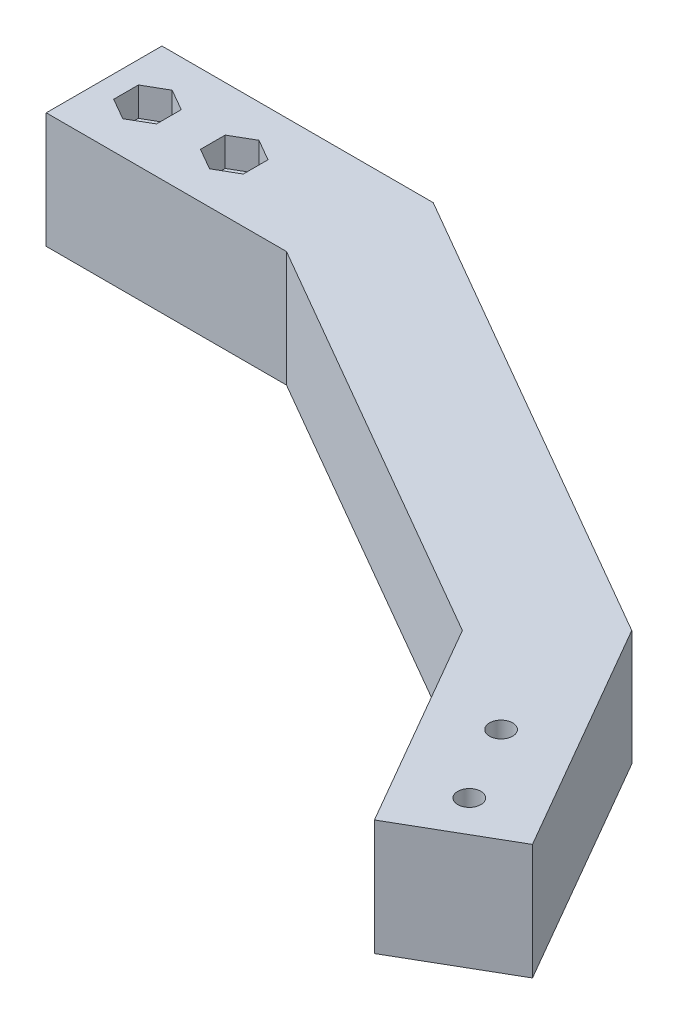
from build123d import *

# Parameters (mm, degrees)
BOSS_EXTRUDE1_DEPTH = 20
SKETCH2_R           = 2
CUT_EXTRUDE1_DEPTH  = 233.365552524
SKETCH2_3_R         = 2
CUT_EXTRUDE2_DEPTH  = 5
CUT_EXTRUDE3_START  = -15
SKETCH2_4_R         = 2
CUT_EXTRUDE3_DEPTH  = 5


with BuildPart() as part:
    # Sketch1 → Boss-Extrude1 (new body)
    with BuildSketch(Plane(origin=(0, 0, 0), x_dir=(1, 0, 0), z_dir=(0, 1, 0))):
        Polygon((0, 155), (0, 175), (46.891108675, 175), (128.108891325, 128.108891325), (151.554445662, 87.5), (134.233937587, 77.5), (113.467875173, 113.467875173), (41.532124827, 155), align=None)
    extrude(amount=BOSS_EXTRUDE1_DEPTH)

    # Sketch2 → Cut-Extrude1 (cut, through all)
    with BuildSketch(Plane(origin=(0, 20, 0), x_dir=(1, 0, 0), z_dir=(0, 1, 0))):
        with Locations(Location((7.5, 165, 0), (0, 0, 270))):
            Circle(SKETCH2_R)
        with Locations(Location((22.5, 165, 0), (0, 0, 270))):
            Circle(SKETCH2_R)
        with Locations(Location((131.644191624, 101.985571585, 0), (0, 0, 270))):
            Circle(SKETCH2_R)
        with Locations(Location((139.144191624, 88.995190528, 0), (0, 0, 90))):
            Circle(SKETCH2_R)
    extrude(amount=-CUT_EXTRUDE1_DEPTH, mode=Mode.SUBTRACT)

    # Sketch2<3> → Cut-Extrude2 (cut)
    # profile 1 of 2: a face of its own
    with BuildSketch(Plane(origin=(0, 20, 0), x_dir=(1, 0, 0), z_dir=(0, 1, 0))):
        Polygon((3.8, 167.136195996), (3.8, 162.863804004), (7.5, 160.727608008), (11.2, 162.863804004), (11.2, 167.136195996), (7.5, 169.272391992), align=None)
        with Locations(Location((7.5, 165, 0), (0, 0, 270))):
            Circle(SKETCH2_3_R, mode=Mode.SUBTRACT)
    # profile 2 of 2: a face of its own
    with BuildSketch(Plane(origin=(0, 20, 0), x_dir=(1, 0, 0), z_dir=(0, 1, 0))):
        Polygon((26.2, 162.863804004), (26.2, 167.136195996), (22.5, 169.272391992), (18.8, 167.136195996), (18.8, 162.863804004), (22.5, 160.727608008), align=None)
        with Locations(Location((22.5, 165, 0), (0, 0, 270))):
            Circle(SKETCH2_3_R, mode=Mode.SUBTRACT)
    extrude(amount=-CUT_EXTRUDE2_DEPTH, mode=Mode.SUBTRACT)

    # Sketch2<4> → Cut-Extrude3 (cut)
    # profile 1 of 2: a face of its own
    with BuildSketch(Plane(origin=(0, 20, 0), x_dir=(1, 0, 0), z_dir=(0, 1, 0)).offset(CUT_EXTRUDE3_START)):
        Polygon((135.344191624, 104.121767581), (135.344191624, 99.849375589), (131.644191624, 97.713179593), (127.944191624, 99.849375589), (127.944191624, 104.121767581), (131.644191624, 106.257963577), align=None)
        with Locations(Location((131.644191624, 101.985571585, 0), (0, 0, 270))):
            Circle(SKETCH2_4_R, mode=Mode.SUBTRACT)
    # profile 2 of 2: a face of its own
    with BuildSketch(Plane(origin=(0, 20, 0), x_dir=(1, 0, 0), z_dir=(0, 1, 0)).offset(CUT_EXTRUDE3_START)):
        Polygon((135.444191624, 86.858994532), (135.444191624, 91.131386524), (139.144191624, 93.26758252), (142.844191624, 91.131386524), (142.844191624, 86.858994532), (139.144191624, 84.722798536), align=None)
        with Locations(Location((139.144191624, 88.995190528, 0), (0, 0, 270))):
            Circle(SKETCH2_4_R, mode=Mode.SUBTRACT)
    extrude(amount=-CUT_EXTRUDE3_DEPTH, mode=Mode.SUBTRACT)


solid = part.part
